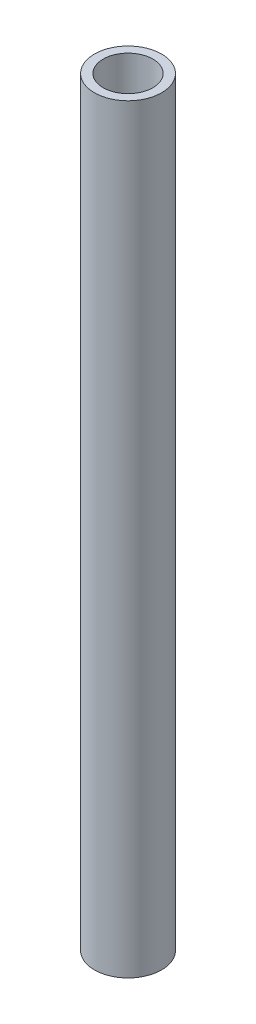
from build123d import *

# Parameters (mm, degrees)
SKETCH1_R           = 10.668
SKETCH1_R_2         = 7.8994
BOSS_EXTRUDE1_DEPTH = 241.3


with BuildPart() as part:
    # Sketch1 → Boss-Extrude1 (new body)
    with BuildSketch(Plane(origin=(0, 0, 0), x_dir=(1, 0, 0), z_dir=(0, 1, 0))):
        with Locations(Location((0, 0, 0), (0, 0, 90))):
            Circle(SKETCH1_R)
        with Locations(Location((0, 0, 0), (0, 0, 90))):
            Circle(SKETCH1_R_2, mode=Mode.SUBTRACT)
    extrude(amount=BOSS_EXTRUDE1_DEPTH)


solid = part.part
